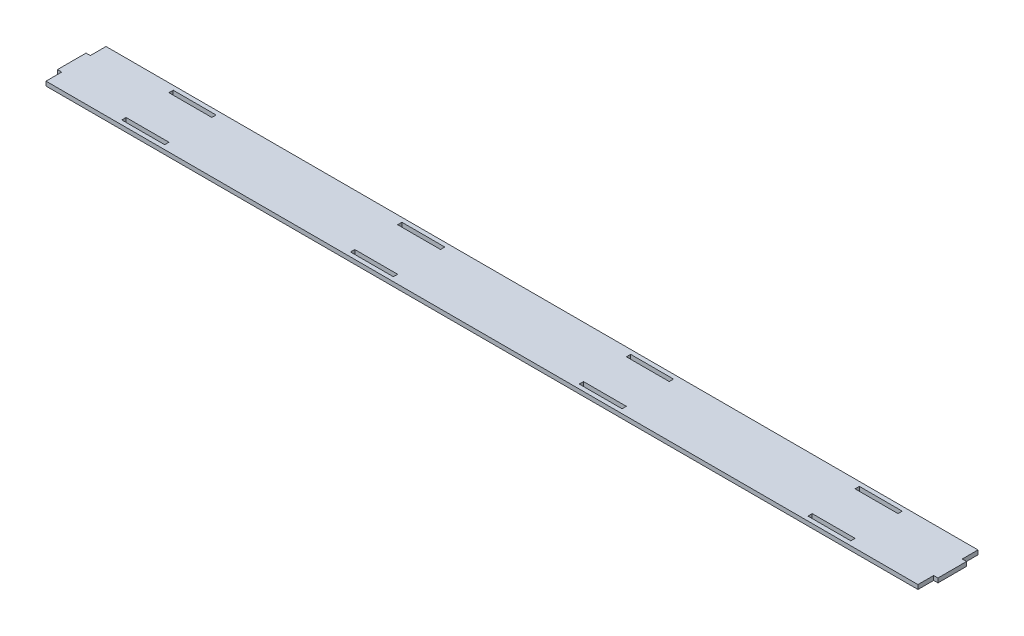
from build123d import *

# Parameters (mm, degrees)
SKETCH1_W           = 30
SKETCH1_H           = 3
BOSS_EXTRUDE1_DEPTH = 3


with BuildPart() as part:
    # Sketch1 → Boss-Extrude1 (new body)
    with BuildSketch(Plane(origin=(0, 0, 0), x_dir=(1, 0, 0), z_dir=(0, 1, 0))):
        Polygon((0, 0), (610, 0), (610, 11), (613, 11), (613, 31), (610, 31), (610, 42), (0, 42), (0, 31), (-3, 31), (-3, 11), (0, 11), align=None)
        with Locations((65, 4.5)):
            Rectangle(SKETCH1_W, SKETCH1_H, mode=Mode.SUBTRACT)
        with Locations((225, 4.5)):
            Rectangle(SKETCH1_W, SKETCH1_H, mode=Mode.SUBTRACT)
        with Locations((385, 4.5)):
            Rectangle(SKETCH1_W, SKETCH1_H, mode=Mode.SUBTRACT)
        with Locations((545, 4.5)):
            Rectangle(SKETCH1_W, SKETCH1_H, mode=Mode.SUBTRACT)
        with Locations((545, 37.5)):
            Rectangle(SKETCH1_W, SKETCH1_H, mode=Mode.SUBTRACT)
        with Locations((385, 37.5)):
            Rectangle(SKETCH1_W, SKETCH1_H, mode=Mode.SUBTRACT)
        with Locations((225, 37.5)):
            Rectangle(SKETCH1_W, SKETCH1_H, mode=Mode.SUBTRACT)
        with Locations((65, 37.5)):
            Rectangle(SKETCH1_W, SKETCH1_H, mode=Mode.SUBTRACT)
    extrude(amount=BOSS_EXTRUDE1_DEPTH)


solid = part.part
